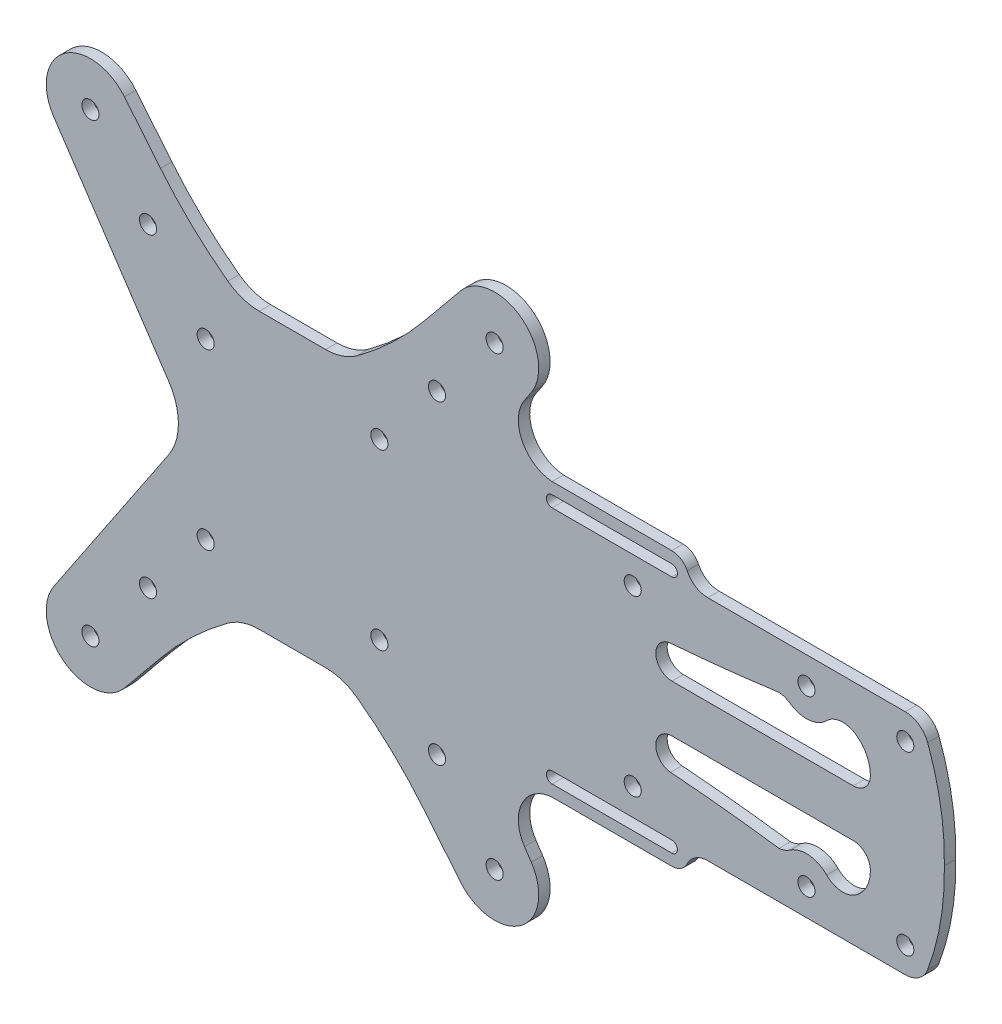
from build123d import *

# Parameters (mm, degrees)
CROQUIS1_R              = 1.5
CROQUIS1_R_2            = 1.499997567
CROQUIS1_R_3            = 1.499999659
SALIENTE_EXTRUIR1_DEPTH = 2


with BuildPart() as part:
    # Croquis1 → Saliente-Extruir1 (new body)
    with BuildSketch(Plane.XY):
        with BuildLine():
            Line((-41.931739537, 35.719555975), (-21.729231, 5.566101))
            ThreePointArc((-21.729231, 5.566101), (-20.036969421, 4.8e-08), (-21.729230683, -5.566101))
            Line((-21.729230683, -5.566101), (-41.931739683, -35.719556))
            ThreePointArc((-41.931739683, -35.719556), (-40.113877545, -46.255199079), (-29.502526011, -44.949972494))
            Line((-29.502526011, -44.949972494), (-23.17774412, -37.243793058))
            ThreePointArc((-23.17774412, -37.243793058), (-17.619189001, -31.253867186), (-11.353005357, -26.008708515))
            ThreePointArc((-11.353005357, -26.008708515), (-8.734615775, -24.660409187), (-5.826392082, -24.195532826))
            Line((-5.826392082, -24.195532826), (-8.2e-08, -24.195532826))
            Line((-8.2e-08, -24.195532826), (5.826391918, -24.195532937))
            ThreePointArc((5.826391918, -24.195532937), (8.734615571, -24.66040906), (11.3530052, -26.008708126))
            ThreePointArc((11.3530052, -26.008708126), (17.61928276, -31.253858591), (23.177925918, -37.243793826))
            Line((23.177925918, -37.243793826), (29.502525918, -44.949971826))
            ThreePointArc((29.502525918, -44.949971826), (40.113877545, -46.255199018), (41.931739905, -35.719555809))
            Line((41.931739905, -35.719555809), (40.742639905, -33.944752809))
            ThreePointArc((40.742639905, -33.944752809), (40.308182186, -27.575684066), (45.596686, -23.999999855))
            Line((45.596686, -23.999999855), (66.596686, -23.999999855))
            ThreePointArc((66.596686, -23.999999855), (68.20025333, -23.53546267), (69.307209533, -22.285714318))
            ThreePointArc((69.307209533, -22.285714318), (70.783151209, -20.619383034), (72.921241131, -20.000000062))
            Line((72.921241131, -20.000000062), (107.612588131, -20.000000062))
            ThreePointArc((107.612588131, -20.000000062), (110.006914278, -19.249811766), (111.54509388, -17.267494009))
            ThreePointArc((111.54509388, -17.267494009), (113.827321023, -8.772459026), (114.473968651, -5.93e-07))
            ThreePointArc((114.473968651, -5.93e-07), (113.827320947, 8.772458604), (111.545093444, 17.267494286))
            ThreePointArc((111.545093444, 17.267494286), (110.006913893, 19.249811756), (107.612588, 20))
            Line((107.612588, 20), (72.921241, 20))
            ThreePointArc((72.921241, 20), (70.783151239, 20.619383073), (69.307209698, 22.285714308))
            ThreePointArc((69.307209698, 22.285714308), (68.200253441, 23.535462771), (66.596686, 24))
            Line((66.596686, 24), (45.596686, 24))
            ThreePointArc((45.596686, 24), (40.308182457, 27.575684295), (40.74263977, 33.944752888))
            Line((40.74263977, 33.944752888), (41.93173977, 35.719555888))
            ThreePointArc((41.93173977, 35.719555888), (40.113879793, 46.255201891), (29.502526087, 44.949972367))
            Line((29.502526087, 44.949972367), (23.177744038, 37.243793232))
            ThreePointArc((23.177744038, 37.243793232), (17.619188919, 31.25386736), (11.353005274, 26.008708689))
            ThreePointArc((11.353005274, 26.008708689), (8.734615693, 24.660409361), (5.826392, 24.195533))
            Line((5.826392, 24.195533), (0, 24.195533))
            Line((0, 24.195533), (-5.826392, 24.195533111))
            ThreePointArc((-5.826392, 24.195533111), (-8.734615653, 24.660409234), (-11.353005282, 26.0087083))
            ThreePointArc((-11.353005282, 26.0087083), (-17.619282842, 31.253858765), (-23.177926, 37.243794))
            Line((-23.177926, 37.243794), (-29.502526, 44.949972))
            ThreePointArc((-29.502526, 44.949972), (-40.113877138, 46.255198613), (-41.931739537, 35.719555975))
        make_face()
        with Locations((59.75, -15.25)):
            Circle(CROQUIS1_R, mode=Mode.SUBTRACT)
        with Locations((-15.25, -15.25)):
            Circle(CROQUIS1_R, mode=Mode.SUBTRACT)
        with Locations((35.493242084, -40.033283689)):
            Circle(CROQUIS1_R, mode=Mode.SUBTRACT)
        with Locations((107.612588, -15.5)):
            Circle(CROQUIS1_R, mode=Mode.SUBTRACT)
        with Locations((-35.493241837, -40.033283897)):
            Circle(CROQUIS1_R, mode=Mode.SUBTRACT)
        with Locations((15.25, 15.25)):
            Circle(CROQUIS1_R, mode=Mode.SUBTRACT)
        with Locations((59.75, 15.25)):
            Circle(CROQUIS1_R, mode=Mode.SUBTRACT)
        with Locations((-25.371621, -27.641642)):
            Circle(CROQUIS1_R, mode=Mode.SUBTRACT)
        with Locations((-25.371621, 27.641642)):
            Circle(CROQUIS1_R, mode=Mode.SUBTRACT)
        with Locations((35.493244203, 40.033286852)):
            Circle(CROQUIS1_R_2, mode=Mode.SUBTRACT)
        with Locations((107.612588, 15.5)):
            Circle(CROQUIS1_R, mode=Mode.SUBTRACT)
        with Locations((-35.493241659, 40.033283492)):
            Circle(CROQUIS1_R_3, mode=Mode.SUBTRACT)
        with Locations((90.249999894, -15.249999839)):
            Circle(CROQUIS1_R, mode=Mode.SUBTRACT)
        with Locations((90.24999988, 15.250000209)):
            Circle(CROQUIS1_R, mode=Mode.SUBTRACT)
        with Locations((-15.25, 15.25)):
            Circle(CROQUIS1_R, mode=Mode.SUBTRACT)
        with Locations((25.371621, -27.641642)):
            Circle(CROQUIS1_R, mode=Mode.SUBTRACT)
        with Locations((15.25, -15.25)):
            Circle(CROQUIS1_R, mode=Mode.SUBTRACT)
        with Locations((25.371621, 27.641642)):
            Circle(CROQUIS1_R, mode=Mode.SUBTRACT)
        with BuildLine():
            Line((98.473924, 4.165983), (66.629579, 4.165983))
            ThreePointArc((66.629579, 4.165983), (63.80116944, 6.88617712), (66.409010926, 9.818500341))
            ThreePointArc((66.409010926, 9.818500341), (75.942438766, 10.701918647), (85.446477477, 11.859468837))
            ThreePointArc((85.446477477, 11.859468837), (86.461547798, 11.633214666), (87.383984261, 11.152933833))
            ThreePointArc((87.383984261, 11.152933833), (90.700963866, 10.270378747), (93.80542655, 11.734471854))
            ThreePointArc((93.80542655, 11.734471854), (96.321235225, 12.908534532), (98.995308731, 12.162178491))
            ThreePointArc((98.995308731, 12.162178491), (100.881174903, 9.908695061), (101.470839807, 7.02998457))
            ThreePointArc((101.470839807, 7.02998457), (100.546603986, 4.997112873), (98.473924, 4.165983))
        make_face(mode=Mode.SUBTRACT)
        with BuildLine():
            Line((66.596686, -22), (45.596686, -22))
            ThreePointArc((45.596686, -22), (44.596686, -21), (45.596686, -20))
            Line((45.596686, -20), (66.596686, -20))
            ThreePointArc((66.596686, -20), (67.596686, -21), (66.596686, -22))
        make_face(mode=Mode.SUBTRACT)
        with BuildLine():
            Line((66.596686, 22), (45.596686, 22))
            ThreePointArc((45.596686, 22), (44.596686, 21), (45.596686, 20))
            Line((45.596686, 20), (66.596686, 20))
            ThreePointArc((66.596686, 20), (67.596686, 21), (66.596686, 22))
        make_face(mode=Mode.SUBTRACT)
        with BuildLine():
            Line((98.473923843, -4.165983), (66.629579, -4.165983))
            ThreePointArc((66.629579, -4.165983), (63.801171492, -6.886177421), (66.409011186, -9.818500536))
            ThreePointArc((66.409011186, -9.818500536), (75.942439193, -10.70191878), (85.446478074, -11.859468919))
            ThreePointArc((85.446478074, -11.859468919), (86.461548299, -11.633214373), (87.383984575, -11.152933205))
            ThreePointArc((87.383984575, -11.152933205), (90.700964079, -10.270378355), (93.805426592, -11.734471456))
            ThreePointArc((93.805426592, -11.734471456), (96.32123511, -12.908534134), (98.995308527, -12.162178296))
            ThreePointArc((98.995308527, -12.162178296), (100.881169052, -9.908693453), (101.470829573, -7.029984658))
            ThreePointArc((101.470829573, -7.029984658), (100.546597424, -4.997116386), (98.473923843, -4.165983))
        make_face(mode=Mode.SUBTRACT)
    extrude(amount=SALIENTE_EXTRUIR1_DEPTH)


solid = part.part
